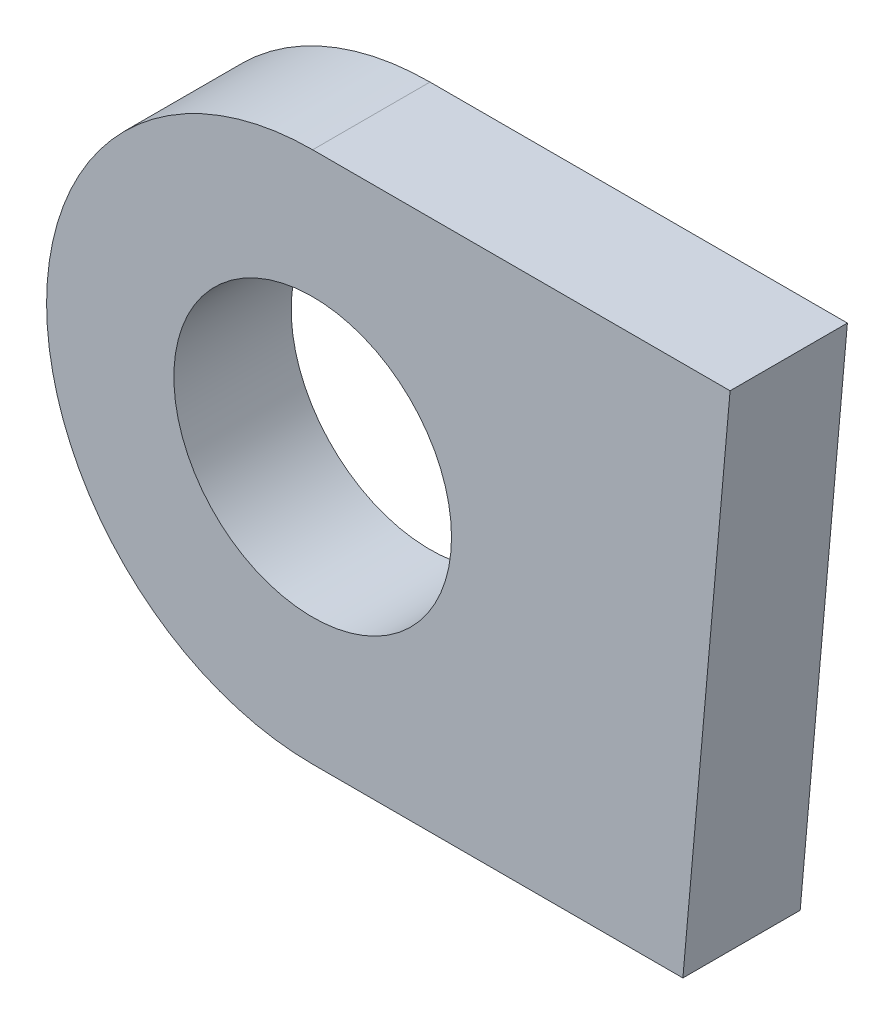
from build123d import *

# Parameters (mm, degrees)
SKETCH1_R           = 6
BOSS_EXTRUDE1_DEPTH = 2.535


with BuildPart() as part:
    # Sketch1 → Boss-Extrude1 (new, symmetric)
    # profile 1 of 2: a face of its own
    with BuildSketch(Plane(origin=(0, 0, 0), x_dir=(0, 1, 0), z_dir=(0, 0, 1))):
        with BuildLine():
            ThreePointArc((11.5, 0), (0, 11.5), (-11.5, 0))
            ThreePointArc((-11.5, 0), (0, -11.5), (11.5, 0))
        make_face()
        with Locations(Location((0, 0, 0), (0, 0, 270))):
            Circle(SKETCH1_R, mode=Mode.SUBTRACT)
    # profile 2 of 2: a face of its own
    with BuildSketch(Plane(origin=(0, 0, 0), x_dir=(0, 1, 0), z_dir=(0, 0, 1))):
        with BuildLine():
            ThreePointArc((11.5, 0), (0, -11.5), (-11.5, 0))
            Line((-11.5, 0), (-11.5, -16))
            Line((-11.5, -16), (11.5, -18.040557186))
            Line((11.5, -18.040557186), (11.5, 0))
        make_face()
    extrude(amount=BOSS_EXTRUDE1_DEPTH, both=True)


solid = part.part
